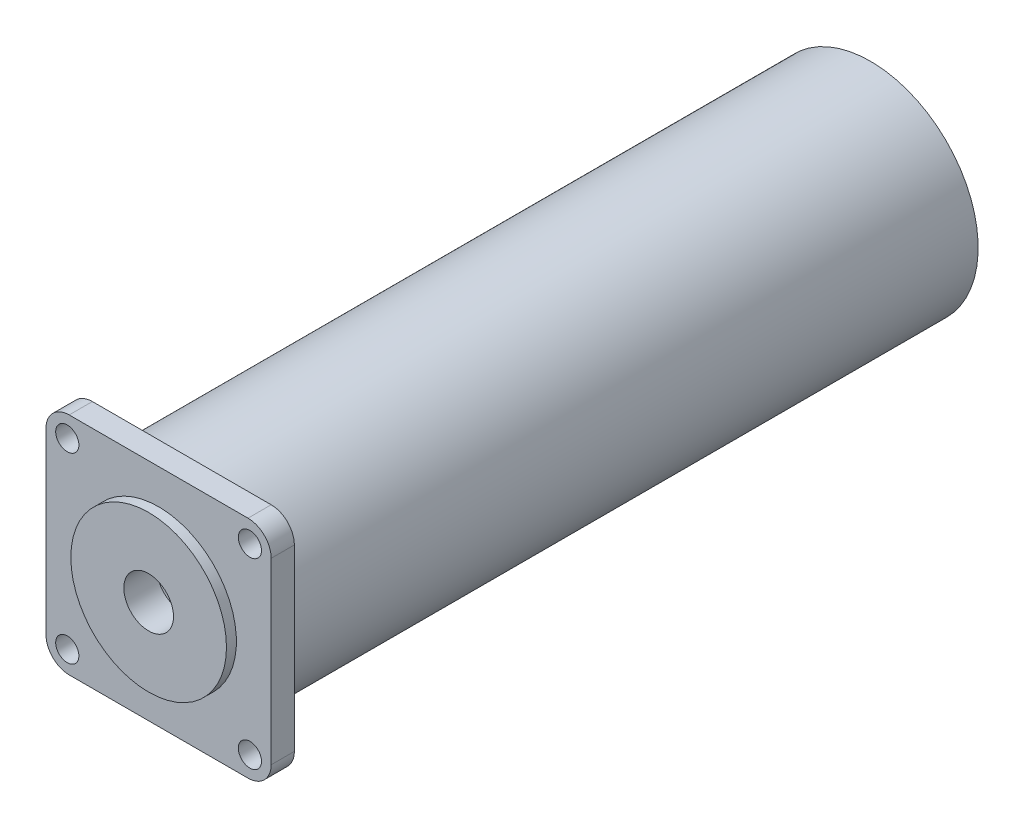
from build123d import *

# Parameters (mm, degrees)
SKETCH1_R           = 7.5
SKETCH1_R_2         = 3.5
BOSS_EXTRUDE1_DEPTH = 7
SKETCH2_R           = 32.5
BOSS_EXTRUDE2_DEPTH = 208
BOSS_EXTRUDE3_START = 3
SKETCH3_R           = 23.5
SKETCH3_R_2         = 7.5
BOSS_EXTRUDE3_DEPTH = 3


with BuildPart() as part:
    # Sketch1 → Boss-Extrude1 (new body)
    with BuildSketch(Plane.XY):
        with BuildLine():
            Line((-27, -34), (27, -34))
            ThreePointArc((27, -34), (31.949747468, -31.949747468), (34, -27))
            Line((34, -27), (34, 27))
            ThreePointArc((34, 27), (31.949747468, 31.949747468), (27, 34))
            Line((27, 34), (-27, 34))
            ThreePointArc((-27, 34), (-31.949747468, 31.949747468), (-34, 27))
            Line((-34, 27), (-34, -27))
            ThreePointArc((-34, -27), (-31.949747468, -31.949747468), (-27, -34))
        make_face()
        Circle(SKETCH1_R, mode=Mode.SUBTRACT)
        with Locations((27.577164466, 27.577164466)):
            Circle(SKETCH1_R_2, mode=Mode.SUBTRACT)
        with Locations((-27.577164466, 27.577164466)):
            Circle(SKETCH1_R_2, mode=Mode.SUBTRACT)
        with Locations((-27.577164466, -27.577164466)):
            Circle(SKETCH1_R_2, mode=Mode.SUBTRACT)
        with Locations((27.577164466, -27.577164466)):
            Circle(SKETCH1_R_2, mode=Mode.SUBTRACT)
    extrude(amount=-BOSS_EXTRUDE1_DEPTH)

    # Sketch2 → Boss-Extrude2 (add)
    with BuildSketch(Plane(origin=(0, 0, -7), x_dir=(-1, 0, 0), z_dir=(0, 0, -1))):
        with Locations(Location((0, 0, 0), (0, 0, 180))):
            Circle(SKETCH2_R)
    extrude(amount=BOSS_EXTRUDE2_DEPTH)

    # Sketch3 → Boss-Extrude3 (add)
    with BuildSketch(Plane.XY.offset(BOSS_EXTRUDE3_START)):
        with Locations(Location((0, 0, 0), (0, 0, 180))):
            Circle(SKETCH3_R)
        Circle(SKETCH3_R_2, mode=Mode.SUBTRACT)
    extrude(amount=-BOSS_EXTRUDE3_DEPTH)


solid = part.part
